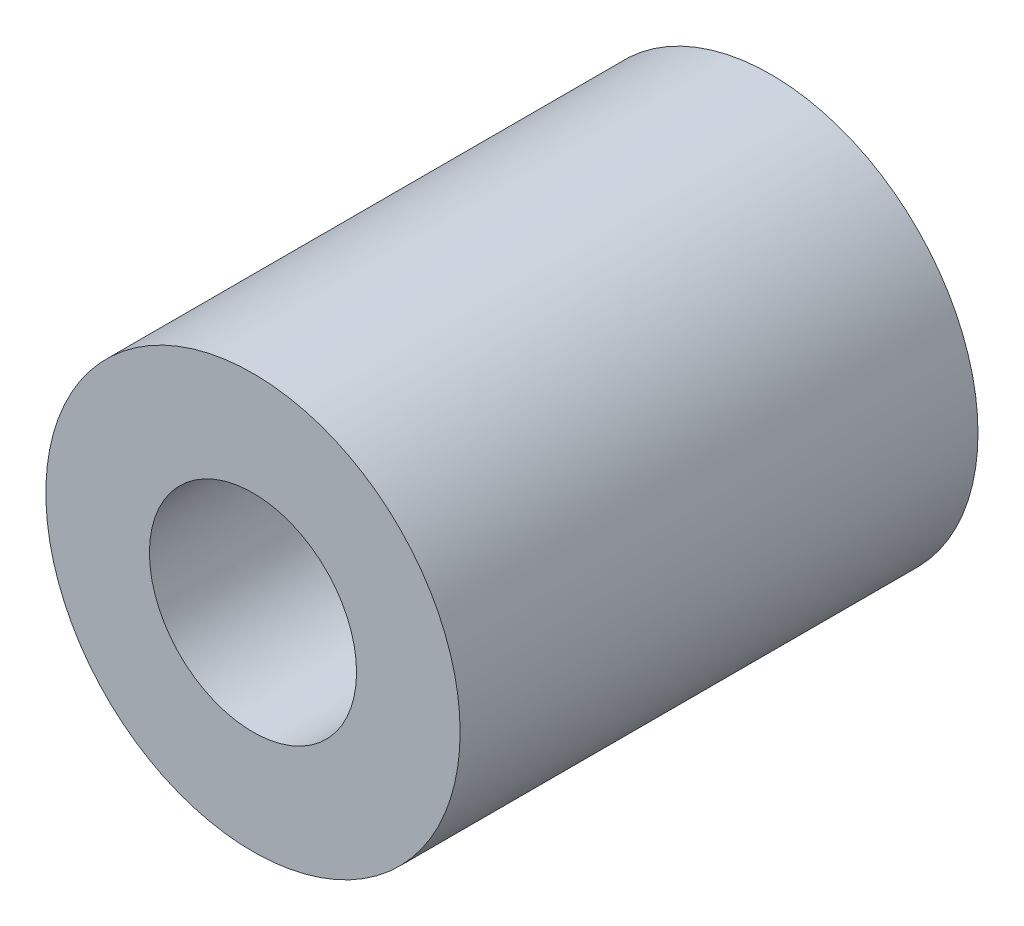
from build123d import *

# Parameters (mm, degrees)
SKETCH1_R           = 2
SKETCH1_R_2         = 1
BOSS_EXTRUDE1_DEPTH = 5


with BuildPart() as part:
    # Sketch1 → Boss-Extrude1 (new body)
    with BuildSketch(Plane.XY):
        Circle(SKETCH1_R)
        Circle(SKETCH1_R_2, mode=Mode.SUBTRACT)
    extrude(amount=BOSS_EXTRUDE1_DEPTH)


solid = part.part
